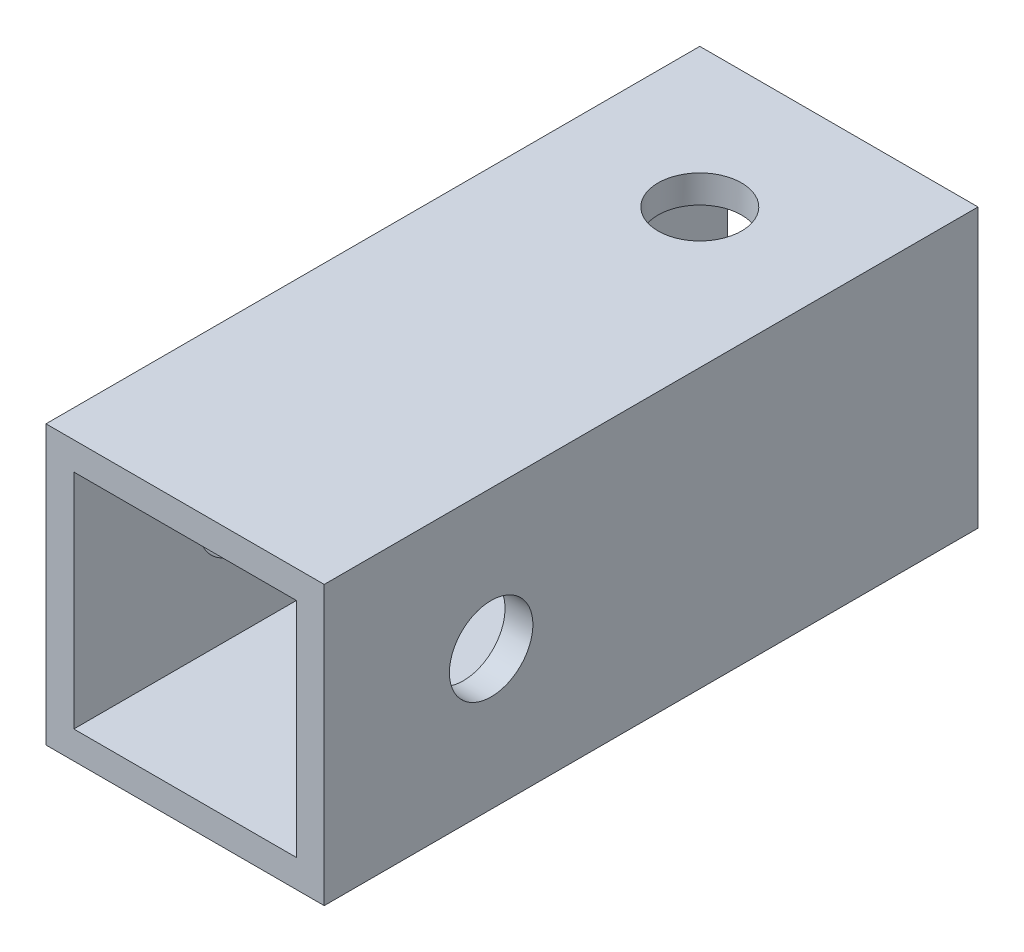
from build123d import *

# Parameters (mm, degrees)
SKETCH_1_W          = 10
SKETCH_1_H          = 10
SKETCH_1_W_2        = 8
SKETCH_1_H_2        = 8
EXTRUDE_1_DEPTH     = 23.5
SKETCH_2_R          = 1.5
CUT_EXTRUDE_1_DEPTH = 27.024027359
SKETCH_3_R          = 1.5
CUT_EXTRUDE_2_DEPTH = 27.024027359


with BuildPart() as part:
    # ｽｹｯﾁ1 → 押し出し-薄板1 (new body)
    with BuildSketch(Plane.XY):
        Rectangle(SKETCH_1_W, SKETCH_1_H)
        Rectangle(SKETCH_1_W_2, SKETCH_1_H_2, mode=Mode.SUBTRACT)
    extrude(amount=EXTRUDE_1_DEPTH)

    # ｽｹｯﾁ2 → ｶｯﾄ - 押し出し1 (cut, through all)
    with BuildSketch(Plane(origin=(0, 5, 0), x_dir=(1, 0, 0), z_dir=(0, 1, 0))):
        with Locations(Location((0, -5, 0), (0, 0, 270))):
            Circle(SKETCH_2_R)
    extrude(amount=-CUT_EXTRUDE_1_DEPTH, mode=Mode.SUBTRACT)

    # ｽｹｯﾁ3 → ｶｯﾄ - 押し出し2 (cut, through all)
    with BuildSketch(Plane.ZY.offset(5)):
        with Locations((17.5, 0)):
            Circle(SKETCH_3_R)
    extrude(amount=-CUT_EXTRUDE_2_DEPTH, mode=Mode.SUBTRACT)


solid = part.part
